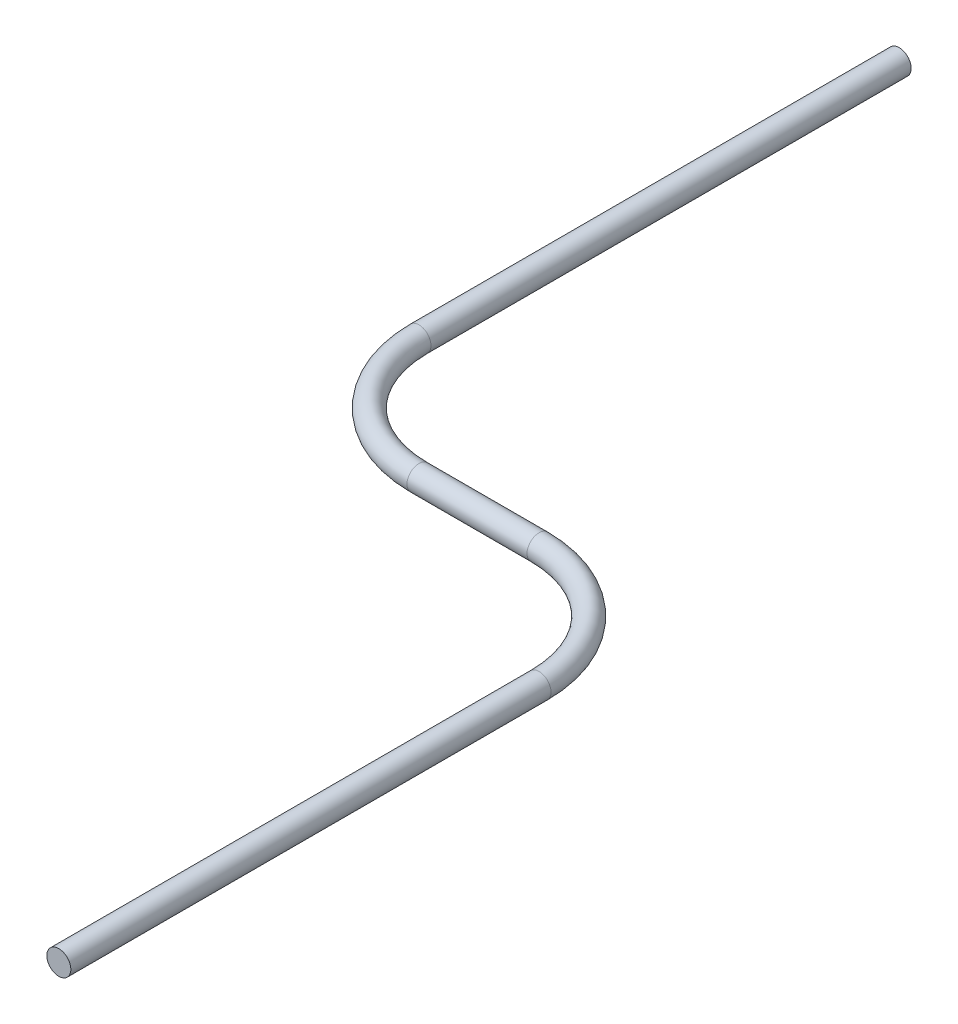
from build123d import *

# Parameters (mm, degrees)
SKETCH_1_R = 1


with BuildPart() as part:
    # ｽｲｰﾌﾟ1: sweep along a path in ｽｹｯﾁ2
    with BuildLine(Plane(origin=(0, 0, 0), x_dir=(1, 0, 0), z_dir=(0, 1, 0))) as sweep_1_path:
        Line((0, 0), (0, -40))
        ThreePointArc((0, -40), (2.928932188, -47.071067812), (10, -50))
        Line((10, -50), (20, -50))
        ThreePointArc((20, -50), (27.071067812, -52.928932188), (30, -60))
        Line((30, -60), (30, -100))
    # ｽｹｯﾁ1 → ｽｲｰﾌﾟ1 (sweep)
    with BuildSketch(Plane.XY):
        Circle(SKETCH_1_R)
    sweep(path=sweep_1_path.line)


solid = part.part
